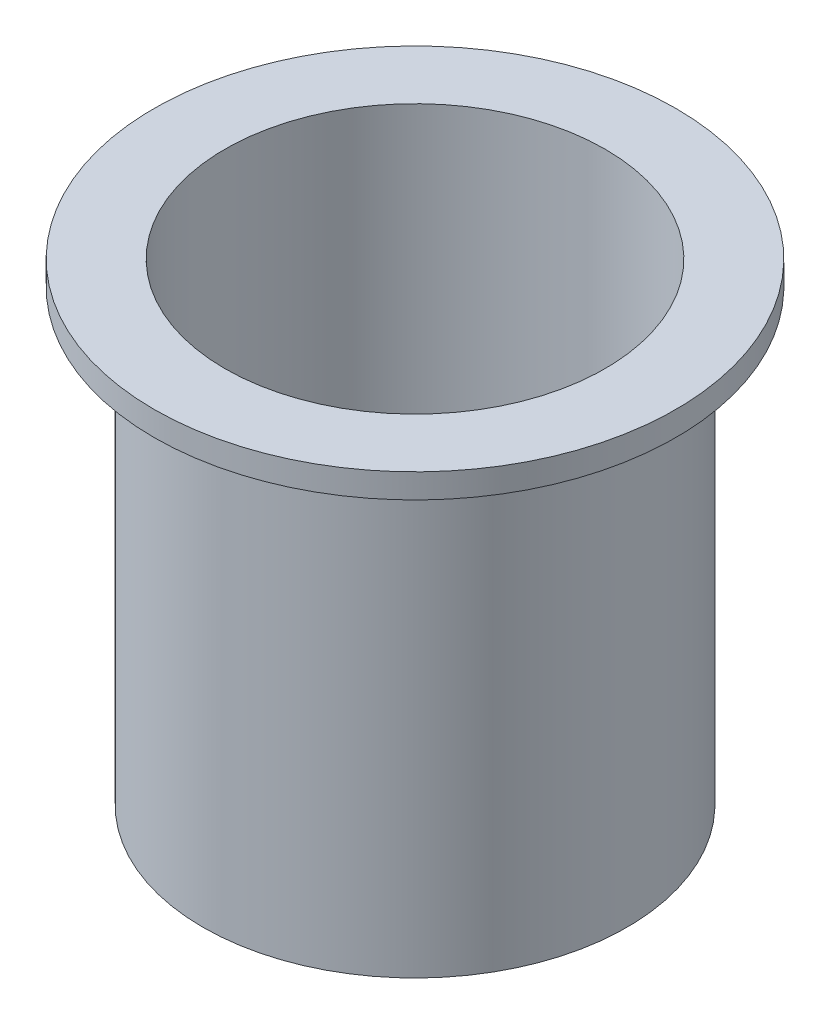
from build123d import *

# Parameters (mm, degrees)
SKETCH1_R           = 43.5
SKETCH1_R_2         = 38.5
BOSS_EXTRUDE3_DEPTH = 95
SKETCH3_R           = 53.5
BOSS_EXTRUDE4_DEPTH = 5
SKETCH4_R           = 38.5
CUT_EXTRUDE1_DEPTH  = 5
SKETCH5_R           = 39
CUT_EXTRUDE2_DEPTH  = 120
SKETCH6_R           = 43.5
CUT_EXTRUDE3_DEPTH  = 3


with BuildPart() as part:
    # Sketch1 → Boss-Extrude3 (new body)
    with BuildSketch(Plane(origin=(0, 0, 0), x_dir=(1, 0, 0), z_dir=(0, 1, 0))):
        with Locations(Location((0, 0, 0), (0, 0, 270))):
            Circle(SKETCH1_R)
        with Locations(Location((0, 0, 0), (0, 0, 270))):
            Circle(SKETCH1_R_2, mode=Mode.SUBTRACT)
    extrude(amount=BOSS_EXTRUDE3_DEPTH)

    # Sketch3 → Boss-Extrude4 (add)
    with BuildSketch(Plane(origin=(0, 95, 0), x_dir=(1, 0, 0), z_dir=(0, 1, 0))):
        with Locations(Location((0, 0, 0), (0, 0, 270))):
            Circle(SKETCH3_R)
    extrude(amount=BOSS_EXTRUDE4_DEPTH)

    # Sketch4 → Cut-Extrude1 (cut)
    with BuildSketch(Plane.XZ.offset(-95)):
        with Locations(Location((0, 0, 0), (0, 0, 270))):
            Circle(SKETCH4_R)
    extrude(amount=-CUT_EXTRUDE1_DEPTH, mode=Mode.SUBTRACT)

    # Sketch5 → Cut-Extrude2 (cut)
    with BuildSketch(Plane(origin=(0, 100, 0), x_dir=(1, 0, 0), z_dir=(0, 1, 0))):
        with Locations(Location((0, 0, 0), (0, 0, 270))):
            Circle(SKETCH5_R)
    extrude(amount=-CUT_EXTRUDE2_DEPTH, mode=Mode.SUBTRACT)

    # Sketch6 → Cut-Extrude3 (cut)
    with BuildSketch(Plane.XZ):
        with Locations(Location((0, 0, 0), (0, 0, 270))):
            Circle(SKETCH6_R)
    extrude(amount=-CUT_EXTRUDE3_DEPTH, mode=Mode.SUBTRACT)


solid = part.part
